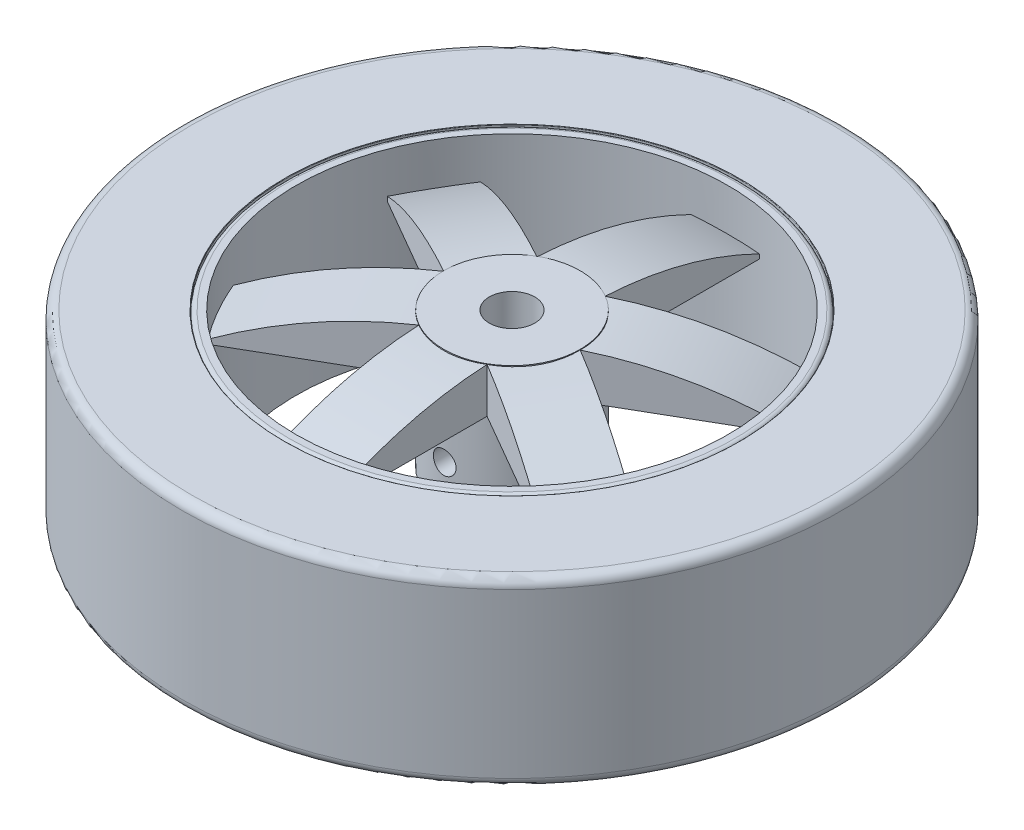
from build123d import *

# Parameters (mm, degrees)
SKETCH1_R             = 50
SKETCH1_R_2           = 47.5
BOSS_EXTRUDE1_DEPTH   = 40
SKETCH1_R_3           = 15
SKETCH1_R_4           = 5
BOSS_EXTRUDE1_2_DEPTH = 40
BOSS_EXTRUDE2_DEPTH   = 7.5
CIRPATTERN1_COUNT     = 6
FILLET1_R             = 1
SKETCH5_R             = 72.5
SKETCH5_R_2           = 50
BOSS_EXTRUDE4_DEPTH   = 40
FILLET2_R             = 2
FILLET3_R             = 0.1
SKETCH7_R             = 15
CUT_EXTRUDE1_DEPTH    = 10
SKETCH8_R             = 2.5
CUT_EXTRUDE2_DEPTH    = 17.5


with BuildPart() as part:
    # Sketch1 → Boss-Extrude1 (new body)
    with BuildSketch(Plane(origin=(0, 0, 0), x_dir=(1, 0, 0), z_dir=(0, 1, 0))):
        with Locations(Location((0, 0, 0), (0, 0, 270))):
            Circle(SKETCH1_R)
        with Locations(Location((0, 0, 0), (0, 0, 270))):
            Circle(SKETCH1_R_2, mode=Mode.SUBTRACT)
    extrude(amount=BOSS_EXTRUDE1_DEPTH)

    # Sketch2 → Boss-Extrude2 (add, symmetric)
    with BuildSketch(Plane(origin=(0, 0, 0), x_dir=(0, 0, -1), z_dir=(1, 0, 0))):
        with BuildLine():
            Line((48.889169482, 30), (8.889169482, 30))
            Line((8.889169482, 30), (8.889169482, 40))
            add(Edge.make_bspline(
                [(8.889169482, 40), (29.868778493, 39.876907844), (48.889169482, 30)],
                knots=[0, 0, 0, 1, 1, 1], degree=2))
        make_face()
    boss_extrude2 = extrude(amount=BOSS_EXTRUDE2_DEPTH, both=True)

    # CirPattern1: Boss-Extrude2 ×6 about axis
    cirpattern1_axis = Axis((0, 40, 0), (0, 1, 0))
    for i in range(1, CIRPATTERN1_COUNT):
        add(boss_extrude2.rotate(cirpattern1_axis, i * 360 / CIRPATTERN1_COUNT))

    # Fillet1
    fillet1_edges = [part.edges().sort_by_distance(p)[0] for p in [
        (0, 40, -50),
        (0, 0, -50),
    ]]
    fillet(fillet1_edges, radius=FILLET1_R)


with BuildPart() as body_2:
    # Sketch1 → Boss-Extrude1 2 (new body)
    with BuildSketch(Plane(origin=(0, 0, 0), x_dir=(1, 0, 0), z_dir=(0, 1, 0))):
        with Locations(Location((0, 0, 0), (0, 0, 270))):
            Circle(SKETCH1_R_3)
        with Locations(Location((0, 0, 0), (0, 0, 270))):
            Circle(SKETCH1_R_4, mode=Mode.SUBTRACT)
    extrude(amount=BOSS_EXTRUDE1_2_DEPTH)


    add(part.part)  # Boss-Extrude4 merges part
    # Sketch5 → Boss-Extrude4 (add)
    with BuildSketch(Plane(origin=(0, 0, 0), x_dir=(1, 0, 0), z_dir=(0, 1, 0))):
        with Locations(Location((0, 0, 0), (0, 0, 270))):
            Circle(SKETCH5_R)
        with Locations(Location((0, 0, 0), (0, 0, 270))):
            Circle(SKETCH5_R_2, mode=Mode.SUBTRACT)
    extrude(amount=BOSS_EXTRUDE4_DEPTH)

    # Fillet2
    fillet2_edges = [body_2.edges().sort_by_distance(p)[0] for p in [
        (0, 40, -72.5),
        (0, 0, -72.5),
    ]]
    fillet(fillet2_edges, radius=FILLET2_R)

    # Fillet3
    fillet3_edges = [body_2.edges().sort_by_distance(p)[0] for p in [
        (0, 40, -50),
    ]]
    fillet(fillet3_edges, radius=FILLET3_R)

    # Sketch7 → Cut-Extrude1 (cut)
    with BuildSketch(Plane.XZ):
        with Locations(Location((0, 0, 0), (0, 0, 270))):
            Circle(SKETCH7_R)
    extrude(amount=-CUT_EXTRUDE1_DEPTH, mode=Mode.SUBTRACT)

    # Sketch8 → Cut-Extrude2 (cut, symmetric)
    with BuildSketch(Plane.XY):
        with Locations((0, 18.5)):
            Circle(SKETCH8_R)
    extrude(amount=CUT_EXTRUDE2_DEPTH, both=True, mode=Mode.SUBTRACT)


solid = body_2.part
